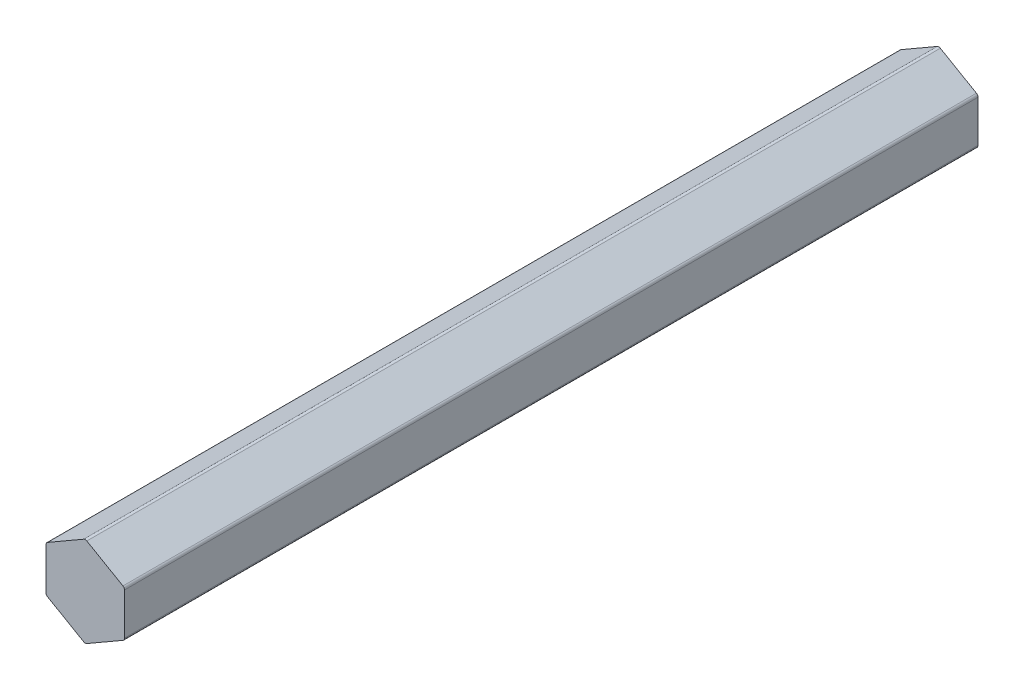
from build123d import *

# Parameters (mm, degrees)
SHAFT_BOSS_DEPTH = 138.06003
FILLET1_R        = 0.508


with BuildPart() as part:
    # Sketch1 → Shaft Boss (new body)
    with BuildSketch(Plane.XY):
        Polygon((0, 7.332348419), (-6.35, 3.666174209), (-6.35, -3.666174209), (0, -7.332348419), (6.35, -3.666174209), (6.35, 3.666174209), align=None)
    extrude(amount=SHAFT_BOSS_DEPTH)

    # Fillet1
    fillet1_edges = [part.edges().sort_by_distance(p)[0] for p in [
        (6.35, 3.666174209, 69.030015),
        (6.35, -3.666174209, 69.030015),
        (0, -7.332348419, 69.030015),
        (-6.35, -3.666174209, 69.030015),
        (-6.35, 3.666174209, 69.030015),
        (0, 7.332348419, 69.030015),
    ]]
    fillet(fillet1_edges, radius=FILLET1_R)


solid = part.part
